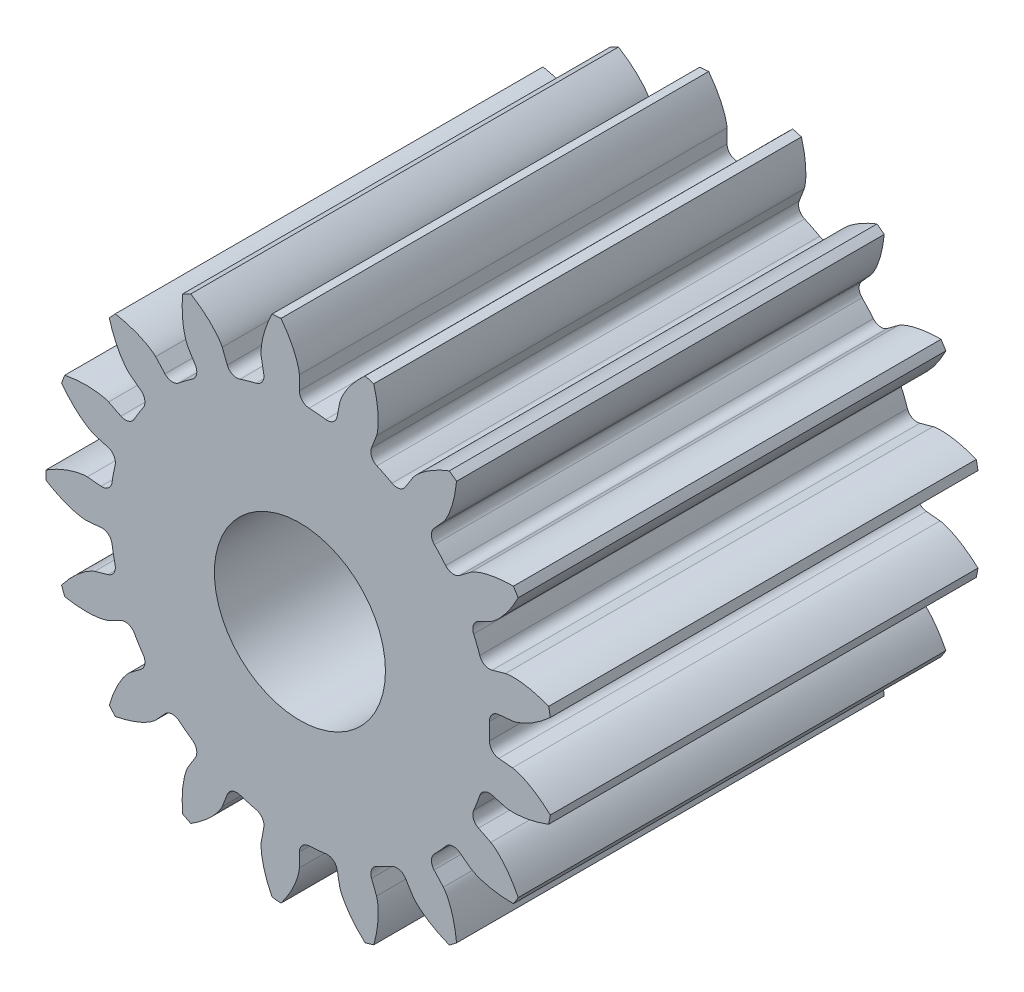
from build123d import *

# Parameters (mm, degrees)
BLANK_SKETCH_R    = 11.875
BLANK_DEPTH       = 20
TOOTH_SPACE_DEPTH = 27.11572802
TEETH_COUNT       = 17
BORE_DEPTH        = 27.100742332
BORE_DEPTH_BACK   = 27.100742332
BORE_SKETCH_R     = 4


with BuildPart() as part:
    # Blank Sketch → Blank (new body)
    with BuildSketch(Plane.XY):
        Circle(BLANK_SKETCH_R)
    extrude(amount=BLANK_DEPTH)

    # Tooth Space Sketch → Tooth Space (cut, symmetric)
    with BuildSketch(Plane.XY):
        with BuildLine():
            Line((9.939079093, 0.948492097), (9.295694704, 0.887093551))
            ThreePointArc((9.295694704, 0.887093551), (8.98235795, 0.725899492), (8.866285625, 0.393197431))
            ThreePointArc((8.866285625, 0.393197431), (8.875, 0), (8.866285625, -0.393197431))
            ThreePointArc((8.866285625, -0.393197431), (8.98235795, -0.725899492), (9.295694704, -0.887093551))
            Line((9.295694704, -0.887093551), (9.939079093, -0.948492097))
            add(Edge.make_bspline(
                [(9.939079093, -0.948492097), (9.944419956, -0.949099255), (9.959363538, -0.951100483), (9.987461284, -0.956060515), (10.033024977, -0.965815194), (10.090612537, -0.980674949), (10.164414462, -1.002652043), (10.250457009, -1.032080202), (10.343964765, -1.068095975), (10.444451681, -1.11120542), (10.543514859, -1.15765376), (10.641151163, -1.207155784), (10.737293163, -1.259303994), (10.852346672, -1.325781398), (10.988299107, -1.410072048), (11.14406597, -1.515140112), (11.316856551, -1.641938971), (11.488524989, -1.779131562), (11.653706097, -1.920614485), (11.816027404, -2.070803406), (11.969819819, -2.2212394), (12.124556639, -2.38463298), (12.26486155, -2.539111634), (12.416223734, -2.71980126), (12.536695511, -2.867871874), (12.656096039, -3.026982739), (12.713455505, -3.105320734), (12.742448933, -3.145730469)],
                knots=[0, 0, 0, 0, 0, 0.005376748, 0.015083688, 0.02853182, 0.046610139, 0.064854849, 0.092110525, 0.119476176, 0.146842495, 0.174208854, 0.201574955, 0.228941013, 0.256307345, 0.307035032, 0.361767351, 0.41649966, 0.471231936, 0.525964282, 0.580696615, 0.635428982, 0.690161387, 0.744893688, 0.799626082, 0.854358408, 0.909090915, 0.909090915, 0.909090915, 0.909090915, 0.909090915], degree=4))
            Line((12.742448933, -3.145730469), (12.742448933, 3.145730469))
            add(Edge.make_bspline(
                [(9.939079093, 0.948492097), (9.944419956, 0.949099255), (9.959363538, 0.951100483), (9.987461284, 0.956060515), (10.033024977, 0.965815194), (10.090612537, 0.980674949), (10.164414462, 1.002652043), (10.250457009, 1.032080202), (10.343964765, 1.068095975), (10.444451681, 1.11120542), (10.543514859, 1.15765376), (10.641151163, 1.207155784), (10.737293163, 1.259303994), (10.852346672, 1.325781398), (10.988299107, 1.410072048), (11.14406597, 1.515140112), (11.316856551, 1.641938971), (11.488524989, 1.779131562), (11.653706097, 1.920614485), (11.816027404, 2.070803406), (11.969819819, 2.2212394), (12.124556639, 2.38463298), (12.26486155, 2.539111634), (12.416223734, 2.71980126), (12.536695511, 2.867871874), (12.656096039, 3.026982739), (12.713455505, 3.105320734), (12.742448933, 3.145730469)],
                knots=[0, 0, 0, 0, 0, 0.005376748, 0.015083688, 0.02853182, 0.046610139, 0.064854849, 0.092110525, 0.119476176, 0.146842495, 0.174208854, 0.201574955, 0.228941013, 0.256307345, 0.307035032, 0.361767351, 0.41649966, 0.471231936, 0.525964282, 0.580696615, 0.635428982, 0.690161387, 0.744893688, 0.799626082, 0.854358408, 0.909090915, 0.909090915, 0.909090915, 0.909090915, 0.909090915], degree=4))
        make_face()
    tooth_space = extrude(amount=TOOTH_SPACE_DEPTH, both=True, mode=Mode.SUBTRACT)

    # Teeth: Tooth Space ×17 about axis
    teeth_axis = Axis((0, 0, -0.25007105), (0, 0, 1))
    for i in range(1, TEETH_COUNT):
        add(tooth_space.rotate(teeth_axis, i * 360 / TEETH_COUNT), mode=Mode.SUBTRACT)

    # Bore Sketch → Bore (cut, two sides: drawn at the far end of the back side and taken through both)
    with BuildSketch(Plane.XY.offset(-BORE_DEPTH_BACK)):
        Circle(BORE_SKETCH_R)
    extrude(amount=BORE_DEPTH + BORE_DEPTH_BACK, mode=Mode.SUBTRACT)


solid = part.part
